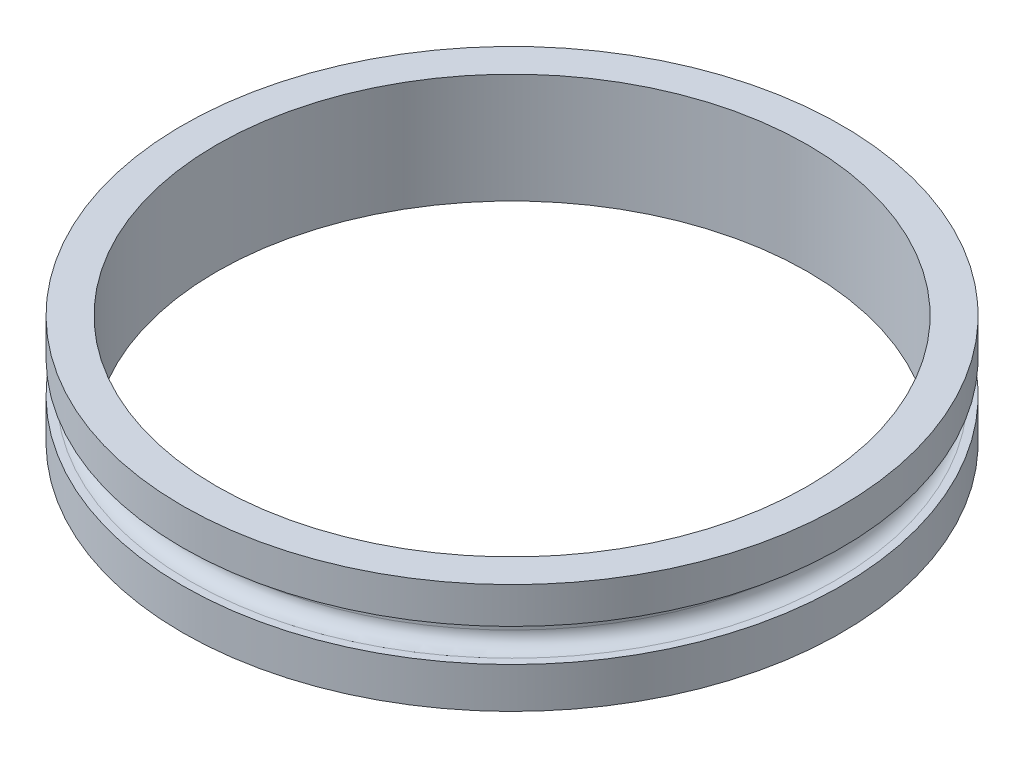
from build123d import *

# Parameters (mm, degrees)
FILLET1_R = 1.651


with BuildPart() as part:
    # Sketch1 → Revolve1 (revolve)
    with BuildSketch(Plane.XY, mode=Mode.PRIVATE) as revolve1_sk:
        Polygon((34.1757, 0), (34.1757, 12.7), (38.1, 12.7), (38.1, 8.509), (35.56, 8.509), (35.56, 4.699), (38.1, 4.699), (38.1, 0), align=None)
    revolve(revolve1_sk.sketch.rotate(Axis((0, 13.335, 0), (0, -1, 0)), 90), axis=Axis((0, 13.335, 0), (0, -1, 0)))

    # Fillet1
    fillet1_edges = [part.edges().sort_by_distance(p)[0] for p in [
        (0, 4.699, -35.56),
        (0, 8.509, -35.56),
    ]]
    fillet(fillet1_edges, radius=FILLET1_R)


solid = part.part
